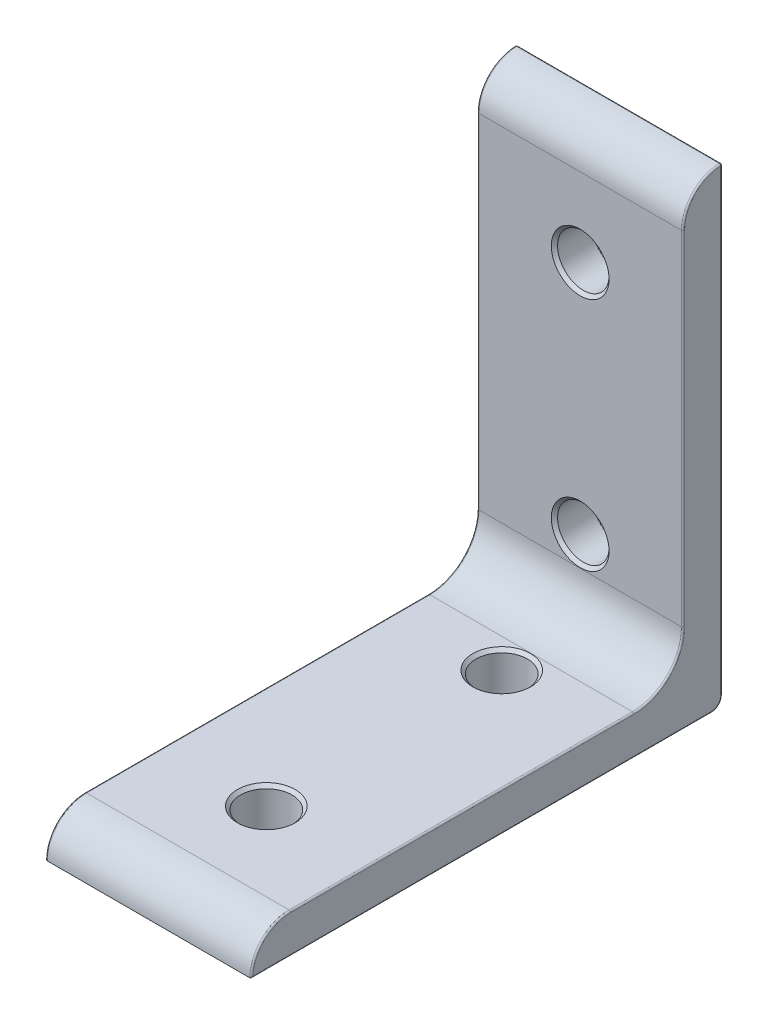
from build123d import *

# Parameters (mm, degrees)
BOSS_EXTRUDE1_START = 16.637
BOSS_EXTRUDE1_DEPTH = 33.274
FILLET1_R           = 1.69545
SKETCH4_R           = 4.1656
CUT_EXTRUDE1_DEPTH  = 82.286052118
SKETCH6_R           = 4.1656
CUT_EXTRUDE3_DEPTH  = 7.874
CHAMFER1_SIZE       = 0.508
FILLET2_R           = 0.254


with BuildPart() as part:
    # Sketch3 → Boss-Extrude1 (new body)
    with BuildSketch(Plane(origin=(0, 0, 0), x_dir=(0, 0, -1), z_dir=(1, 0, 0)).offset(BOSS_EXTRUDE1_START)):
        with BuildLine():
            Line((-7.9375, -31.75), (-63.5, -31.75))
            ThreePointArc((-63.5, -31.75), (-67.990128061, -33.609871939), (-69.85, -38.1))
            Line((-69.85, -38.1), (6.35, -38.1))
            Line((6.35, -38.1), (6.35, 38.1))
            ThreePointArc((6.35, 38.1), (1.859871939, 36.240128061), (0, 31.75))
            Line((0, 31.75), (0, -23.8125))
            ThreePointArc((0, -23.8125), (-2.324839924, -29.425160076), (-7.9375, -31.75))
        make_face()
    extrude(amount=-BOSS_EXTRUDE1_DEPTH)

    # Fillet1
    fillet1_edges = [part.edges().sort_by_distance(p)[0] for p in [
        (0, -38.1, -6.35),
    ]]
    fillet(fillet1_edges, radius=FILLET1_R)

    # Sketch4 → Cut-Extrude1 (cut, through all)
    with BuildSketch(Plane.XY):
        with Locations((0, 19.05)):
            Circle(SKETCH4_R)
        with Locations(Location((0, -19.05, 0), (0, 0, 180))):
            Circle(SKETCH4_R)
    extrude(amount=-CUT_EXTRUDE1_DEPTH, mode=Mode.SUBTRACT)

    # Sketch6 → Cut-Extrude3 (cut)
    with BuildSketch(Plane(origin=(0, -31.75, 0), x_dir=(1, 0, 0), z_dir=(0, 1, 0))):
        with Locations(Location((0, -12.7, 0), (0, 0, 270))):
            Circle(SKETCH6_R)
        with Locations(Location((0, -50.8, 0), (0, 0, 270))):
            Circle(SKETCH6_R)
    extrude(amount=-CUT_EXTRUDE3_DEPTH, mode=Mode.SUBTRACT)

    # Chamfer1
    chamfer1_edges = [part.edges().sort_by_distance(p)[0] for p in [
        (-4.1656, 19.05, 0),
        (4.1656, -19.05, 0),
        (0, -31.75, 8.5344),
        (0, -31.75, 46.6344),
    ]]
    chamfer(chamfer1_edges, length=CHAMFER1_SIZE)

    # Fillet2
    fillet2_edges = [part.edges().sort_by_distance(p)[0] for p in [
        (0, 38.1, -6.35),
        (-16.637, 36.240128061, -1.859871939),
        (-16.637, 3.96875, 0),
        (-16.637, -29.425160076, 2.324839924),
        (16.637, 0.847725, -6.35),
        (-16.637, -31.75, 35.71875),
        (16.637, -37.603414192, -5.853414192),
        (-16.637, 0.847725, -6.35),
        (-16.637, -37.603414192, -5.853414192),
        (-4.1656, 19.05, -6.35),
        (4.1656, -19.05, -6.35),
        (-16.637, -33.609871939, 67.990128061),
        (16.637, -31.75, 35.71875),
        (-16.637, -38.1, 32.597725),
        (16.637, -29.425160076, 2.324839924),
        (16.637, 3.96875, 0),
        (16.637, 36.240128061, -1.859871939),
        (16.637, -38.1, 32.597725),
        (16.637, -33.609871939, 67.990128061),
    ]]
    fillet(fillet2_edges, radius=FILLET2_R)


solid = part.part
